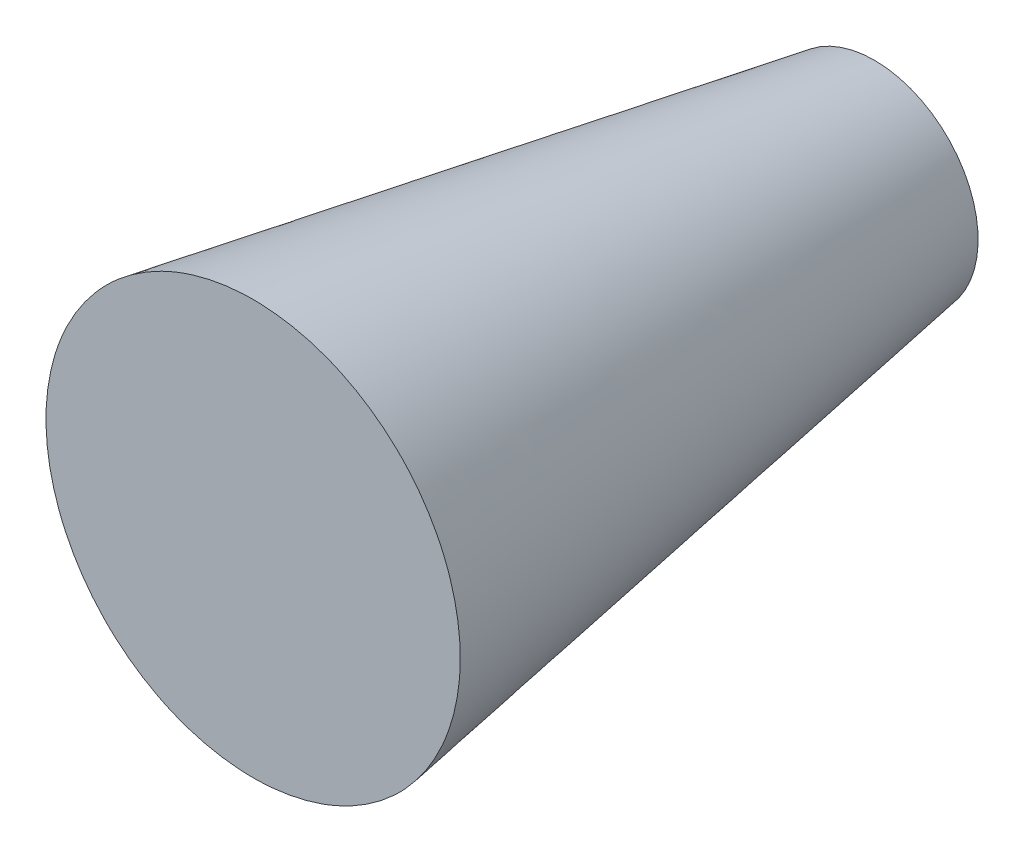
from build123d import *

# Parameters (mm, degrees)
PROFILE1_R = 5
PROFILE2_R = 7.5
PROFILE3_R = 10


with BuildPart() as part:
    # Profile1 → modern_loft_3sections_baseline section 0
    with BuildSketch(Plane.XY):
        Circle(PROFILE1_R)
    # Profile2 → modern_loft_3sections_baseline section 1
    with BuildSketch(Plane.XY.offset(15)):
        Circle(PROFILE2_R)
    # Profile3 → modern_loft_3sections_baseline section 2
    with BuildSketch(Plane.XY.offset(30)):
        Circle(PROFILE3_R)
    loft()


solid = part.part
